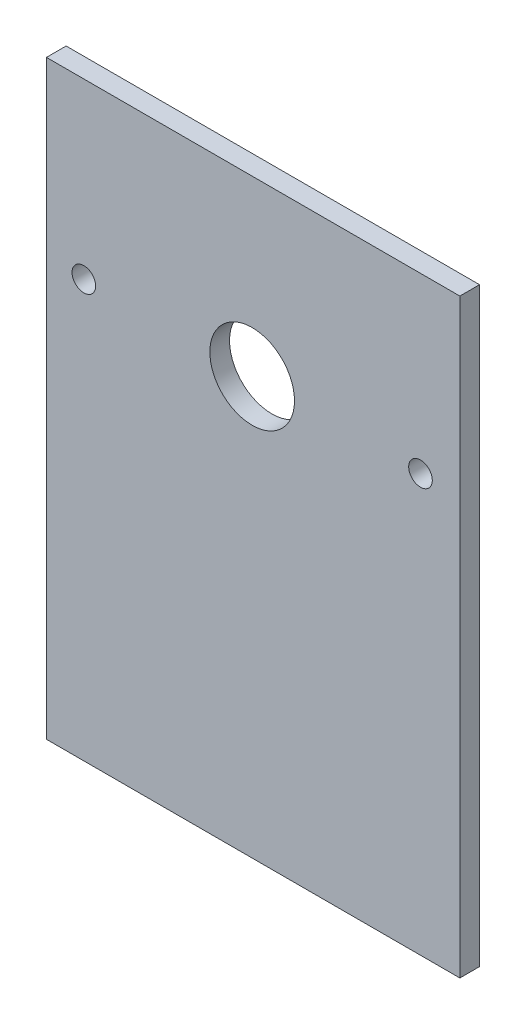
from build123d import *

# Parameters (mm, degrees)
SKETCH2_W           = 105
SKETCH2_H           = 150
BOSS_EXTRUDE1_DEPTH = 5
SKETCH3_R           = 10.75
SKETCH3_R_2         = 3
CUT_EXTRUDE1_DEPTH  = 5


with BuildPart() as part:
    # Sketch2 → Boss-Extrude1 (new body)
    with BuildSketch(Plane.XY):
        with Locations((-52.5, -75)):
            Rectangle(SKETCH2_W, SKETCH2_H)
    extrude(amount=BOSS_EXTRUDE1_DEPTH)

    # Sketch3 → Cut-Extrude1 (cut)
    with BuildSketch(Plane.XY.offset(5)):
        with Locations((-52.75, -44.05)):
            Circle(SKETCH3_R)
        with Locations((-10, -44.05)):
            Circle(SKETCH3_R_2)
        with Locations((-95.5, -44.05)):
            Circle(SKETCH3_R_2)
    extrude(amount=-CUT_EXTRUDE1_DEPTH, mode=Mode.SUBTRACT)


solid = part.part
